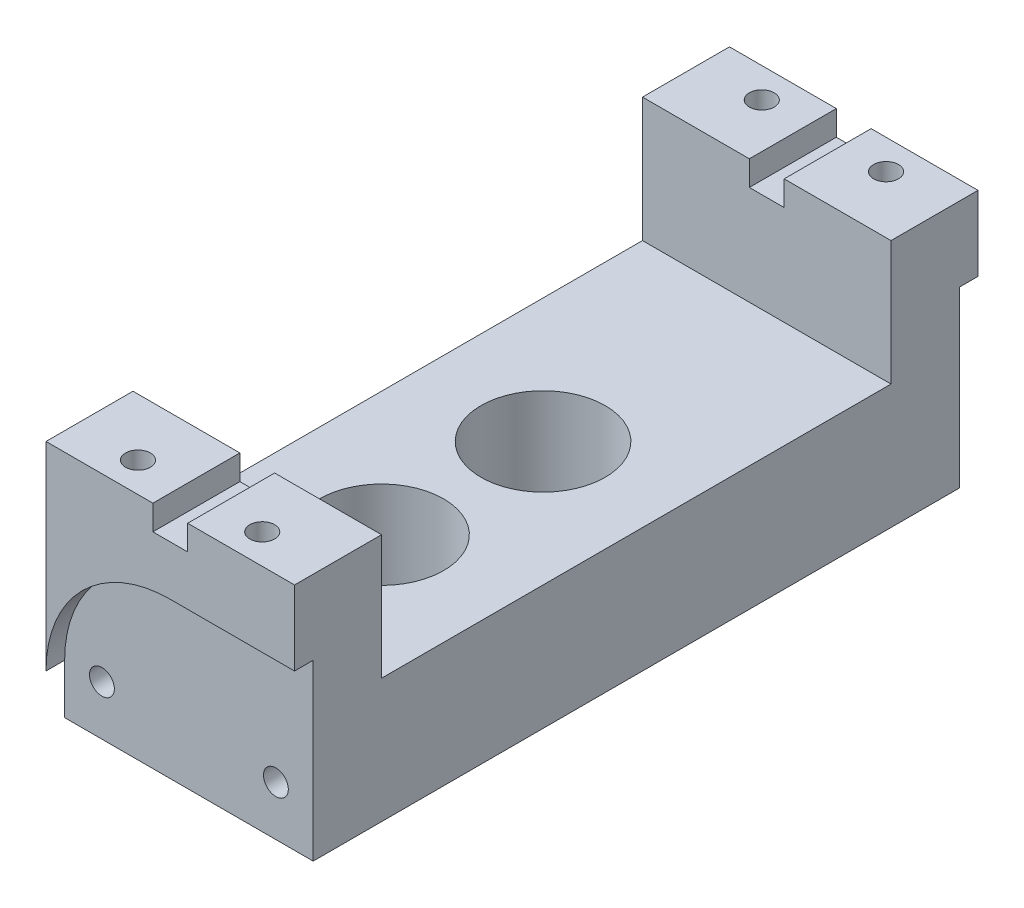
from build123d import *

# Parameters (mm, degrees)
SKETCH_1_W          = 20
SKETCH_1_H          = 55
EXTRUDE_1_DEPTH     = 20
SKETCH_2_W          = 20
SKETCH_2_H          = 41
CUT_EXTRUDE_1_DEPTH = 10
SKETCH_3_W          = 2.8
SKETCH_3_H          = 55
CUT_EXTRUDE_2_DEPTH = 2
SKETCH_4_R          = 1
CUT_EXTRUDE_3_DEPTH = 4
SKETCH_5_R          = 5
CUT_EXTRUDE_4_DEPTH = 62.846584384
SKETCH_6_R          = 1
CUT_EXTRUDE_5_DEPTH = 7
CUT_EXTRUDE_START   = -7
SKETCH_7_R          = 1
CUT_EXTRUDE_6_DEPTH = 7
CUT_EXTRUDE_7_DEPTH = 1.5
CUT_EXTRUDE_START_2 = -1.5
CUT_EXTRUDE_8_DEPTH = 1.5


with BuildPart() as part:
    # Эскиз1 → Бобышка-Вытянуть1 (new body)
    with BuildSketch(Plane(origin=(0, 0, 0), x_dir=(1, 0, 0), z_dir=(0, 1, 0))):
        with Locations((10, 27.5)):
            Rectangle(SKETCH_1_W, SKETCH_1_H)
    extrude(amount=EXTRUDE_1_DEPTH)

    # Эскиз2 → Вырез-Вытянуть1 (cut)
    with BuildSketch(Plane(origin=(0, 20, 0), x_dir=(1, 0, 0), z_dir=(0, 1, 0))):
        with Locations((10, 27.5)):
            Rectangle(SKETCH_2_W, SKETCH_2_H)
    extrude(amount=-CUT_EXTRUDE_1_DEPTH, mode=Mode.SUBTRACT)

    # Эскиз3 → Вырез-Вытянуть2 (cut)
    with BuildSketch(Plane(origin=(0, 20, 0), x_dir=(1, 0, 0), z_dir=(0, 1, 0))):
        with Locations((10, 27.5)):
            Rectangle(SKETCH_3_W, SKETCH_3_H)
    extrude(amount=-CUT_EXTRUDE_2_DEPTH, mode=Mode.SUBTRACT)

    # Эскиз4 → Вырез-Вытянуть3 (cut)
    with BuildSketch(Plane(origin=(0, 20, 0), x_dir=(1, 0, 0), z_dir=(0, 1, 0))):
        with Locations(Location((15, 52.6, 0), (0, 0, 270))):
            Circle(SKETCH_4_R)
        with Locations(Location((5, 52.6, 0), (0, 0, 270))):
            Circle(SKETCH_4_R)
        with Locations(Location((15, 2.4, 0), (0, 0, 270))):
            Circle(SKETCH_4_R)
        with Locations(Location((5, 2.4, 0), (0, 0, 270))):
            Circle(SKETCH_4_R)
    extrude(amount=-CUT_EXTRUDE_3_DEPTH, mode=Mode.SUBTRACT)

    # Эскиз5 → Вырез-Вытянуть4 (cut, through all)
    with BuildSketch(Plane.XZ):
        with Locations(Location((10, -17, 0), (0, 0, 270))):
            Circle(SKETCH_5_R)
        with Locations(Location((10, -30, 0), (0, 0, 270))):
            Circle(SKETCH_5_R)
    extrude(amount=-CUT_EXTRUDE_4_DEPTH, mode=Mode.SUBTRACT)

    # Эскиз6 → Вырез-Вытянуть5 (cut)
    with BuildSketch(Plane(origin=(0, 0, -55), x_dir=(-1, 0, 0), z_dir=(0, 0, -1))):
        with Locations((-17, 4)):
            Circle(SKETCH_6_R)
        with Locations((-3, 4)):
            Circle(SKETCH_6_R)
    extrude(amount=-CUT_EXTRUDE_5_DEPTH, mode=Mode.SUBTRACT)

    # Эскиз7 → Вырез-Вытянуть6 (cut)
    with BuildSketch(Plane.XY.offset(CUT_EXTRUDE_START)):
        with Locations(Location((3, 4, 0), (0, 0, 180))):
            Circle(SKETCH_7_R)
        with Locations(Location((17, 4, 0), (0, 0, 180))):
            Circle(SKETCH_7_R)
    extrude(amount=CUT_EXTRUDE_6_DEPTH, mode=Mode.SUBTRACT)

    # Эскиз8 → Вырез-Вытянуть7 (cut)
    with BuildSketch(Plane(origin=(0, 0, -55), x_dir=(-1, 0, 0), z_dir=(0, 0, -1))):
        with BuildLine():
            Line((-10, 14), (-20, 14))
            Line((-20, 14), (-20, 0))
            Line((-20, 0), (0, 0))
            Line((0, 0), (0, 4))
            ThreePointArc((0, 4), (-2.928932188, 11.071067812), (-10, 14))
        make_face()
    extrude(amount=-CUT_EXTRUDE_7_DEPTH, mode=Mode.SUBTRACT)

    # Эскиз9 → Вырез-Вытянуть8 (cut)
    with BuildSketch(Plane.XY.offset(CUT_EXTRUDE_START_2)):
        with BuildLine():
            Line((0, 4), (0, 0))
            Line((0, 0), (20, 0))
            Line((20, 0), (20, 14))
            Line((20, 14), (10, 14))
            ThreePointArc((10, 14), (2.928932188, 11.071067812), (0, 4))
        make_face()
    extrude(amount=CUT_EXTRUDE_8_DEPTH, mode=Mode.SUBTRACT)


solid = part.part
